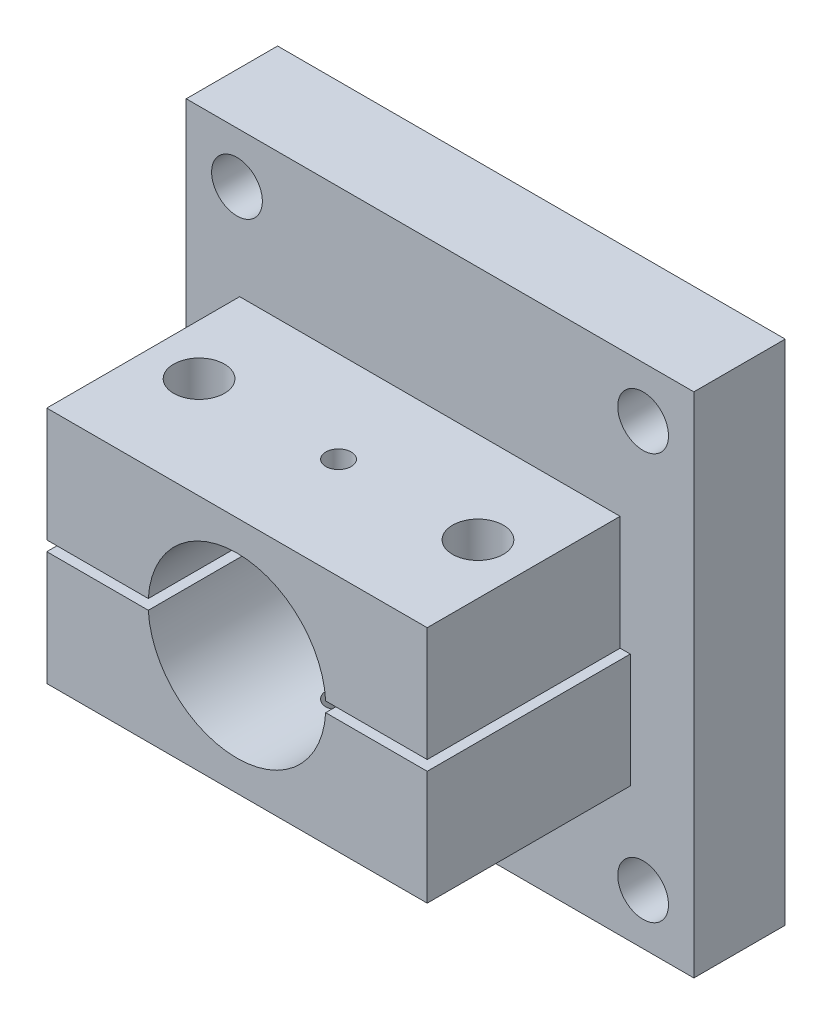
from build123d import *

# Parameters (mm, degrees)
SKETCH1_R               = 3.175
BOSS_EXTRUDE1_DEPTH     = 6.35
BOSS_EXTRUDE2_DEPTH     = 31.75
BOSS_EXTRUDE3_START     = 31.75
BOSS_EXTRUDE3_DEPTH     = 24.13
CUT_EXTRUDE1_DEPTH      = 55.99261314
CUT_EXTRUDE1_DEPTH_BACK = 55.99261314
SKETCH2_R               = 3.175
SKETCH2_R_2             = 1.5875
BOSS_EXTRUDE4_START     = -5.08
SKETCH1_5_R             = 3.175
SKETCH1_5_R_2           = 11.1125
BOSS_EXTRUDE4_DEPTH     = 5.08


with BuildPart() as part:
    # Sketch1 → Boss-Extrude1 (new body)
    # profile 1 of 3: a face of its own
    with BuildSketch(Plane.XY):
        Polygon((31.75, 31.75), (-31.75, 31.75), (-31.75, 0), (-31.75, -0.635), (-31.75, -31.75), (31.75, -31.75), align=None)
        with Locations((-25.4, -25.4)):
            Circle(SKETCH1_R, mode=Mode.SUBTRACT)
        with Locations((25.4, -25.4)):
            Circle(SKETCH1_R, mode=Mode.SUBTRACT)
        with Locations((-25.4, 25.4)):
            Circle(SKETCH1_R, mode=Mode.SUBTRACT)
        with BuildLine():
            Line((-23.794342308, -0.635), (-11.094342308, -0.635))
            ThreePointArc((-11.094342308, -0.635), (-11.1125, 0), (-11.094342308, 0.635))
            Line((-11.094342308, 0.635), (-23.794342308, 0.635))
            Line((-23.794342308, 0.635), (-23.794342308, 14.9225))
            Line((-23.794342308, 14.9225), (23.794342308, 14.9225))
            Line((23.794342308, 14.9225), (23.794342308, 0.635))
            Line((23.794342308, 0.635), (11.094342308, 0.635))
            ThreePointArc((11.094342308, 0.635), (11.107959649, 0.317629777), (11.1125, 0))
            ThreePointArc((11.1125, 0), (11.107959649, -0.317629777), (11.094342308, -0.635))
            Line((11.094342308, -0.635), (23.794342308, -0.635))
            Line((23.794342308, -0.635), (23.794342308, -14.9225))
            Line((23.794342308, -14.9225), (-23.794342308, -14.9225))
            Line((-23.794342308, -14.9225), (-23.794342308, -0.635))
        make_face(mode=Mode.SUBTRACT)
        with Locations((25.4, 25.4)):
            Circle(SKETCH1_R, mode=Mode.SUBTRACT)
    # profile 2 of 3: a face of its own
    with BuildSketch(Plane.XY):
        with BuildLine():
            Line((-23.794342308, 0.635), (-11.094342308, 0.635))
            ThreePointArc((-11.094342308, 0.635), (0, 11.1125), (11.094342308, 0.635))
            Line((11.094342308, 0.635), (23.794342308, 0.635))
            Line((23.794342308, 0.635), (23.794342308, 14.9225))
            Line((23.794342308, 14.9225), (-23.794342308, 14.9225))
            Line((-23.794342308, 14.9225), (-23.794342308, 0.635))
        make_face()
    # profile 3 of 3: a face of its own
    with BuildSketch(Plane.XY):
        with BuildLine():
            ThreePointArc((11.094342308, -0.635), (0, -11.1125), (-11.094342308, -0.635))
            Line((-11.094342308, -0.635), (-23.794342308, -0.635))
            Line((-23.794342308, -0.635), (-23.794342308, -14.9225))
            Line((-23.794342308, -14.9225), (23.794342308, -14.9225))
            Line((23.794342308, -14.9225), (23.794342308, -0.635))
            Line((23.794342308, -0.635), (11.094342308, -0.635))
        make_face()
    extrude(amount=BOSS_EXTRUDE1_DEPTH)

    # Sketch1<3> → Boss-Extrude2 (add)
    with BuildSketch(Plane.XY):
        with BuildLine():
            ThreePointArc((11.094342308, -0.635), (0, -11.1125), (-11.094342308, -0.635))
            Line((-11.094342308, -0.635), (-23.794342308, -0.635))
            Line((-23.794342308, -0.635), (-23.794342308, -14.9225))
            Line((-23.794342308, -14.9225), (23.794342308, -14.9225))
            Line((23.794342308, -14.9225), (23.794342308, -0.635))
            Line((23.794342308, -0.635), (11.094342308, -0.635))
        make_face()
    extrude(amount=BOSS_EXTRUDE2_DEPTH)


with BuildPart() as body_2:
    # Sketch1<4> → Boss-Extrude3 (new body)
    with BuildSketch(Plane.XY.offset(BOSS_EXTRUDE3_START)):
        with BuildLine():
            Line((-23.794342308, 0.635), (-11.094342308, 0.635))
            ThreePointArc((-11.094342308, 0.635), (0, 11.1125), (11.094342308, 0.635))
            Line((11.094342308, 0.635), (23.794342308, 0.635))
            Line((23.794342308, 0.635), (23.794342308, 14.9225))
            Line((23.794342308, 14.9225), (-23.794342308, 14.9225))
            Line((-23.794342308, 14.9225), (-23.794342308, 0.635))
        make_face()
    extrude(amount=-BOSS_EXTRUDE3_DEPTH)


with BuildPart() as cut_extrude1_tool:
    # Sketch2 → Cut-Extrude1 (new, two sides: drawn at the far end of the back side and taken through both)
    with BuildSketch(Plane(origin=(0, 0, 0), x_dir=(1, 0, 0), z_dir=(0, 1, 0)).offset(-CUT_EXTRUDE1_DEPTH_BACK)):
        with Locations(Location((17.444342308, -19.05, 0), (0, 0, 270))):
            Circle(SKETCH2_R)
        with Locations(Location((-17.444342308, -19.05, 0), (0, 0, 270))):
            Circle(SKETCH2_R)
        with Locations(Location((0, -19.05, 0), (0, 0, 270))):
            Circle(SKETCH2_R_2)
    extrude(amount=CUT_EXTRUDE1_DEPTH + CUT_EXTRUDE1_DEPTH_BACK)


with BuildPart() as part_1:
    add(part.part)

    # Cut-Extrude1: cut by cut_extrude1_tool
    add(cut_extrude1_tool.part, mode=Mode.SUBTRACT)

    # Sketch1<5> → Boss-Extrude4 (add)
    # profile 1 of 4: a face of its own
    with BuildSketch(Plane.XY.offset(BOSS_EXTRUDE4_START)):
        Polygon((31.75, 31.75), (-31.75, 31.75), (-31.75, 0), (-31.75, -0.635), (-31.75, -31.75), (31.75, -31.75), align=None)
        with Locations((-25.4, -25.4)):
            Circle(SKETCH1_5_R, mode=Mode.SUBTRACT)
        with Locations((25.4, -25.4)):
            Circle(SKETCH1_5_R, mode=Mode.SUBTRACT)
        with Locations((-25.4, 25.4)):
            Circle(SKETCH1_5_R, mode=Mode.SUBTRACT)
        with BuildLine():
            Line((-23.794342308, -0.635), (-11.094342308, -0.635))
            ThreePointArc((-11.094342308, -0.635), (-11.1125, 0), (-11.094342308, 0.635))
            Line((-11.094342308, 0.635), (-23.794342308, 0.635))
            Line((-23.794342308, 0.635), (-23.794342308, 14.9225))
            Line((-23.794342308, 14.9225), (23.794342308, 14.9225))
            Line((23.794342308, 14.9225), (23.794342308, 0.635))
            Line((23.794342308, 0.635), (11.094342308, 0.635))
            ThreePointArc((11.094342308, 0.635), (11.107959649, 0.317629777), (11.1125, 0))
            ThreePointArc((11.1125, 0), (11.107959649, -0.317629777), (11.094342308, -0.635))
            Line((11.094342308, -0.635), (23.794342308, -0.635))
            Line((23.794342308, -0.635), (23.794342308, -14.9225))
            Line((23.794342308, -14.9225), (-23.794342308, -14.9225))
            Line((-23.794342308, -14.9225), (-23.794342308, -0.635))
        make_face(mode=Mode.SUBTRACT)
        with Locations((25.4, 25.4)):
            Circle(SKETCH1_5_R, mode=Mode.SUBTRACT)
    # profile 2 of 4: a face of its own
    with BuildSketch(Plane.XY.offset(BOSS_EXTRUDE4_START)):
        with BuildLine():
            Line((-23.794342308, 0.635), (-11.094342308, 0.635))
            ThreePointArc((-11.094342308, 0.635), (0, 11.1125), (11.094342308, 0.635))
            Line((11.094342308, 0.635), (23.794342308, 0.635))
            Line((23.794342308, 0.635), (23.794342308, 14.9225))
            Line((23.794342308, 14.9225), (-23.794342308, 14.9225))
            Line((-23.794342308, 14.9225), (-23.794342308, 0.635))
        make_face()
    # profile 3 of 4: a face of its own
    with BuildSketch(Plane.XY.offset(BOSS_EXTRUDE4_START)):
        with Locations(Location((0, 0, 0), (0, 0, 183.27582896))):
            Circle(SKETCH1_5_R_2)
    # profile 4 of 4: a face of its own
    with BuildSketch(Plane.XY.offset(BOSS_EXTRUDE4_START)):
        with BuildLine():
            ThreePointArc((11.094342308, -0.635), (0, -11.1125), (-11.094342308, -0.635))
            Line((-11.094342308, -0.635), (-23.794342308, -0.635))
            Line((-23.794342308, -0.635), (-23.794342308, -14.9225))
            Line((-23.794342308, -14.9225), (23.794342308, -14.9225))
            Line((23.794342308, -14.9225), (23.794342308, -0.635))
            Line((23.794342308, -0.635), (11.094342308, -0.635))
        make_face()
    extrude(amount=BOSS_EXTRUDE4_DEPTH)


with BuildPart() as body_2_1:
    add(body_2.part)

    # Cut-Extrude1: cut by cut_extrude1_tool
    add(cut_extrude1_tool.part, mode=Mode.SUBTRACT)


solid = Compound([part_1.part, body_2_1.part])
